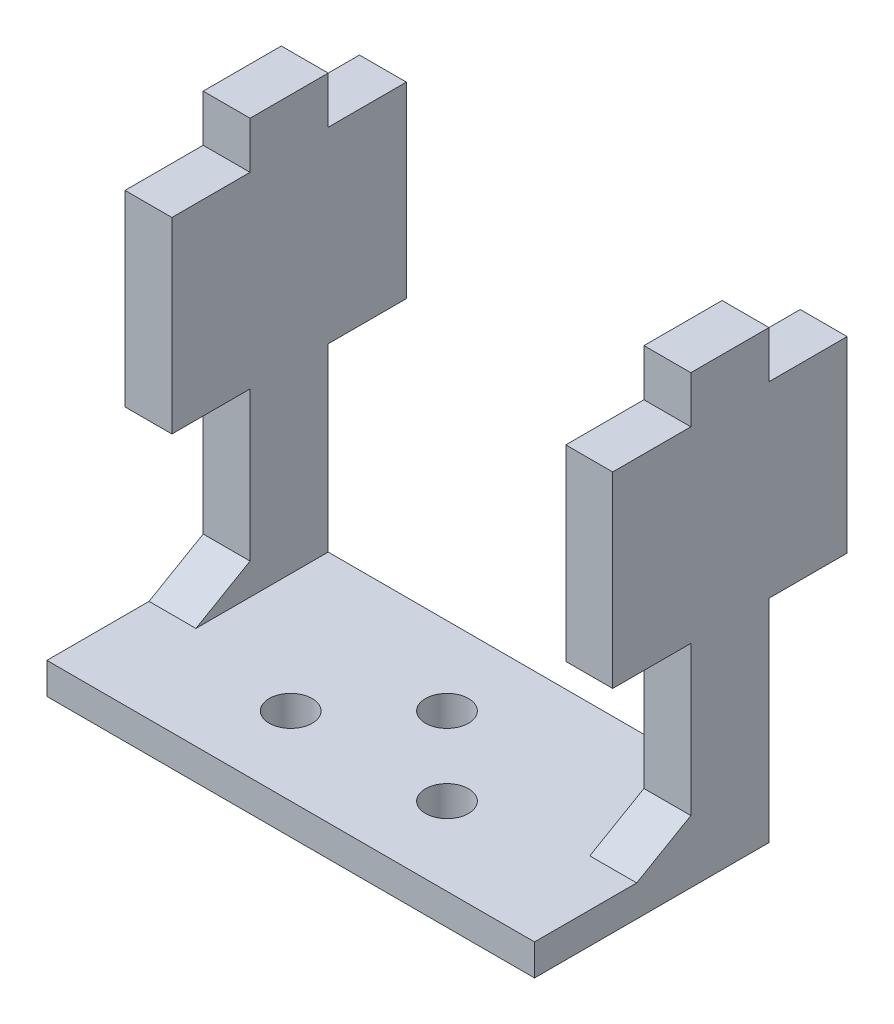
from build123d import *

# Parameters (mm, degrees)
SKETCH1_W                = 31.2
SKETCH1_H                = 15
SKETCH1_R                = 1.375
BOSS_EXTRUDE1_DEPTH      = 2
SKETCH2_W                = 3
SKETCH2_H                = 5
BOSS_EXTRUDE2_DEPTH      = 26.54
BOSS_EXTRUDE3_DEPTH      = 5
BOSS_EXTRUDE3_DEPTH_BACK = 10
SKETCH3_W                = 3
SKETCH3_H                = 12
BOSS_EXTRUDE4_DEPTH      = 3
BOSS_EXTRUDE5_DEPTH      = 3


with BuildPart() as part:
    # Sketch1 → Boss-Extrude1 (new body)
    with BuildSketch(Plane(origin=(0, 0, 0), x_dir=(1, 0, 0), z_dir=(0, 1, 0))):
        with Locations((15.6, 7.5)):
            Rectangle(SKETCH1_W, SKETCH1_H)
        with Locations(Location((15.6, 10, 0), (0, 0, 270))):
            Circle(SKETCH1_R, mode=Mode.SUBTRACT)
        with Locations(Location((10.6, 5, 0), (0, 0, 270))):
            Circle(SKETCH1_R, mode=Mode.SUBTRACT)
        with Locations(Location((20.6, 5, 0), (0, 0, 270))):
            Circle(SKETCH1_R, mode=Mode.SUBTRACT)
    extrude(amount=BOSS_EXTRUDE1_DEPTH)

    # Sketch2 → Boss-Extrude2 (add)
    with BuildSketch(Plane(origin=(0, 2, 0), x_dir=(1, 0, 0), z_dir=(0, 1, 0))):
        with Locations((1.5, 12.5)):
            Rectangle(SKETCH2_W, SKETCH2_H)
        with Locations((29.7, 12.5)):
            Rectangle(SKETCH2_W, SKETCH2_H)
    extrude(amount=BOSS_EXTRUDE2_DEPTH)

    # Sketch3 → Boss-Extrude3 (add, two sides: drawn at the far end of the back side and taken through both)
    with BuildSketch(Plane(origin=(0, 0, -15), x_dir=(-1, 0, 0), z_dir=(0, 0, -1)).offset(-BOSS_EXTRUDE3_DEPTH_BACK)):
        with Locations((-29.7, 19.54)):
            Rectangle(SKETCH3_W, SKETCH3_H)
        with Locations((-1.5, 19.54)):
            Rectangle(SKETCH3_W, SKETCH3_H)
    extrude(amount=BOSS_EXTRUDE3_DEPTH + BOSS_EXTRUDE3_DEPTH_BACK)

    # Sketch5 → Boss-Extrude4 (add)
    with BuildSketch(Plane(origin=(31.2, 0, 0), x_dir=(0, 0, -1), z_dir=(1, 0, 0))):
        Polygon((10, 4), (6.535898385, 2), (10, 2), align=None)
    extrude(amount=-BOSS_EXTRUDE4_DEPTH)

    # Sketch6 → Boss-Extrude5 (add)
    with BuildSketch(Plane(origin=(0, 0, 0), x_dir=(0, 0, -1), z_dir=(1, 0, 0))):
        Polygon((10, 4), (6.535898385, 2), (10, 2), align=None)
    extrude(amount=BOSS_EXTRUDE5_DEPTH)


solid = part.part
